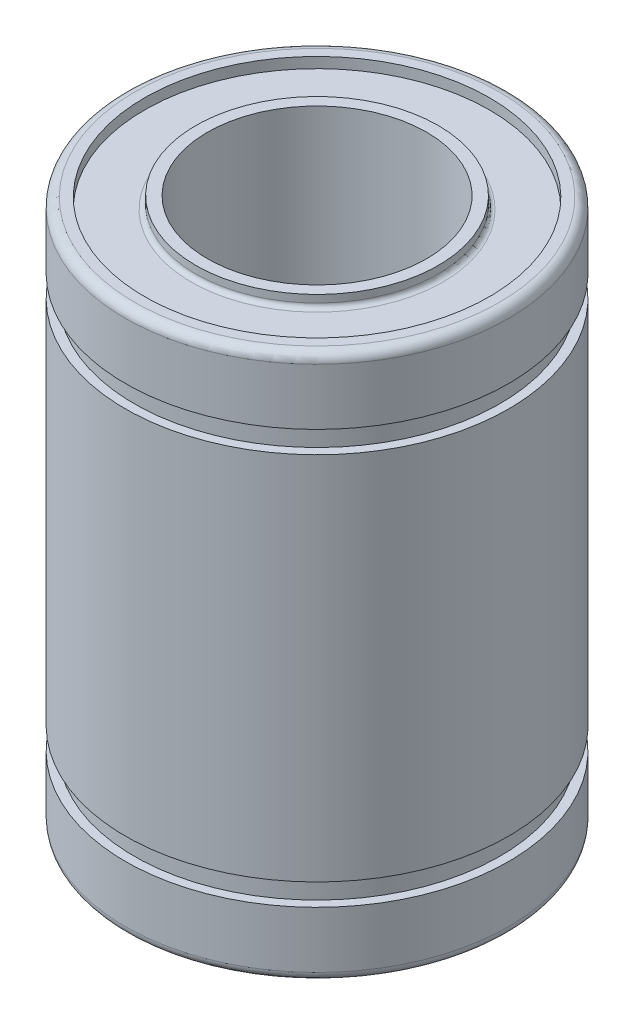
from build123d import *


with BuildPart() as part:
    # Sketch1 → Revolve1 (revolve)
    with BuildSketch(Plane.XY, mode=Mode.PRIVATE) as revolve1_sk:
        with BuildLine():
            Line((6.635, 15.0004), (6, 15.0004))
            Line((6, 15.0004), (6, -15.0004))
            Line((6, -15.0004), (6.635, -15.0004))
            Line((6.635, -15.0004), (6.635, -14.594))
            ThreePointArc((6.635, -14.594), (6.709394878, -14.414394878), (6.889, -14.34))
            Line((6.889, -14.34), (9.435, -14.34))
            Line((9.435, -14.34), (9.435, -14.92))
            Line((9.435, -14.92), (9.977, -14.92))
            ThreePointArc((9.977, -14.92), (10.336210245, -14.771210245), (10.485, -14.412))
            Line((10.485, -14.412), (10.485, -11.325))
            Line((10.485, -11.325), (10, -11.325))
            Line((10, -11.325), (10, -10.125))
            Line((10, -10.125), (10.485, -10.125))
            Line((10.485, -10.125), (10.485, 10.125))
            Line((10.485, 10.125), (10, 10.125))
            Line((10, 10.125), (10, 11.325))
            Line((10, 11.325), (10.485, 11.325))
            Line((10.485, 11.325), (10.485, 14.412))
            ThreePointArc((10.485, 14.412), (10.336210245, 14.771210245), (9.977, 14.92))
            Line((9.977, 14.92), (9.435, 14.92))
            Line((9.435, 14.92), (9.435, 14.34))
            Line((9.435, 14.34), (6.889, 14.34))
            ThreePointArc((6.889, 14.34), (6.709394878, 14.414394878), (6.635, 14.594))
            Line((6.635, 14.594), (6.635, 15.0004))
        make_face()
    revolve(revolve1_sk.sketch.rotate(Axis((0, 15.0004, 0), (0, -1, 0)), 270), axis=Axis((0, 15.0004, 0), (0, -1, 0)))


solid = part.part
